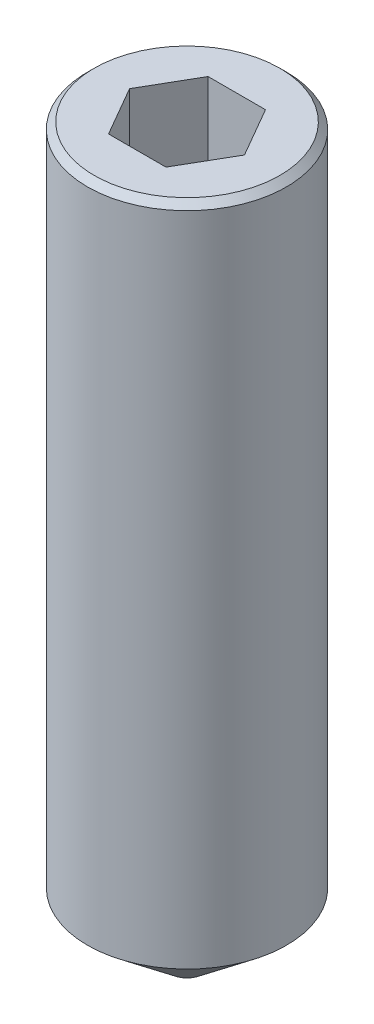
from build123d import *

# Parameters (mm, degrees)
CUT_EXTRUDE_1_DEPTH = 1.5
CHAMFER_1_SIZE      = 0.1


with BuildPart() as part:
    # 草图1 → 旋转1 (revolve)
    with BuildSketch(Plane.XY, mode=Mode.PRIVATE) as revolve_1_sk:
        Polygon((0, 0), (1.5, 0), (1.5, -10), (0.25, -11), (0, -11), align=None)
    revolve(revolve_1_sk.sketch.rotate(Axis((0, 8.713500289, 0), (0, -1, 0)), 90), axis=Axis((0, 8.713500289, 0), (0, -1, 0)))

    # 草图2 → 切除-拉伸1 (cut)
    with BuildSketch(Plane(origin=(0, 0, 0), x_dir=(1, 0, 0), z_dir=(0, 1, 0))):
        Polygon((-0.433012702, -0.75), (0.433012702, -0.75), (0.866025404, 0), (0.433012702, 0.75), (-0.433012702, 0.75), (-0.866025404, 0), align=None)
    extrude(amount=-CUT_EXTRUDE_1_DEPTH, mode=Mode.SUBTRACT)

    # 倒角1
    chamfer_1_edges = [part.edges().sort_by_distance(p)[0] for p in [
        (0, 0, -1.5),
    ]]
    chamfer(chamfer_1_edges, length=CHAMFER_1_SIZE)


solid = part.part
